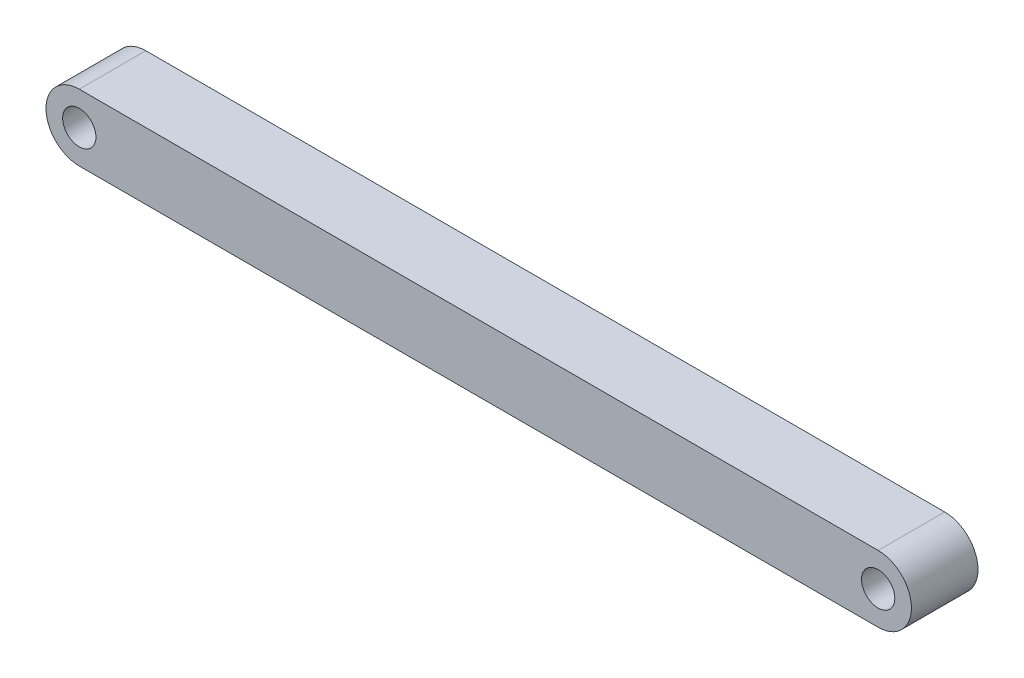
from build123d import *

# Parameters (mm, degrees)
SKETCH_2_R      = 2.5
EXTRUDE_1_DEPTH = 10


with BuildPart() as part:
    # 草图2 → 凸台-拉伸1 (new body)
    with BuildSketch(Plane.XY.offset(21)):
        with BuildLine():
            Line((108.27716468, 70.429340608), (228.27716468, 70.429340608))
            ThreePointArc((228.27716468, 70.429340608), (233.27716468, 65.429340608), (228.27716468, 60.429340608))
            Line((228.27716468, 60.429340608), (108.27716468, 60.429340608))
            ThreePointArc((108.27716468, 60.429340608), (103.27716468, 65.429340608), (108.27716468, 70.429340608))
        make_face()
        with Locations((108.27716468, 65.429340608)):
            Circle(SKETCH_2_R, mode=Mode.SUBTRACT)
        with Locations((228.27716468, 65.429340608)):
            Circle(SKETCH_2_R, mode=Mode.SUBTRACT)
    extrude(amount=EXTRUDE_1_DEPTH)


solid = part.part
